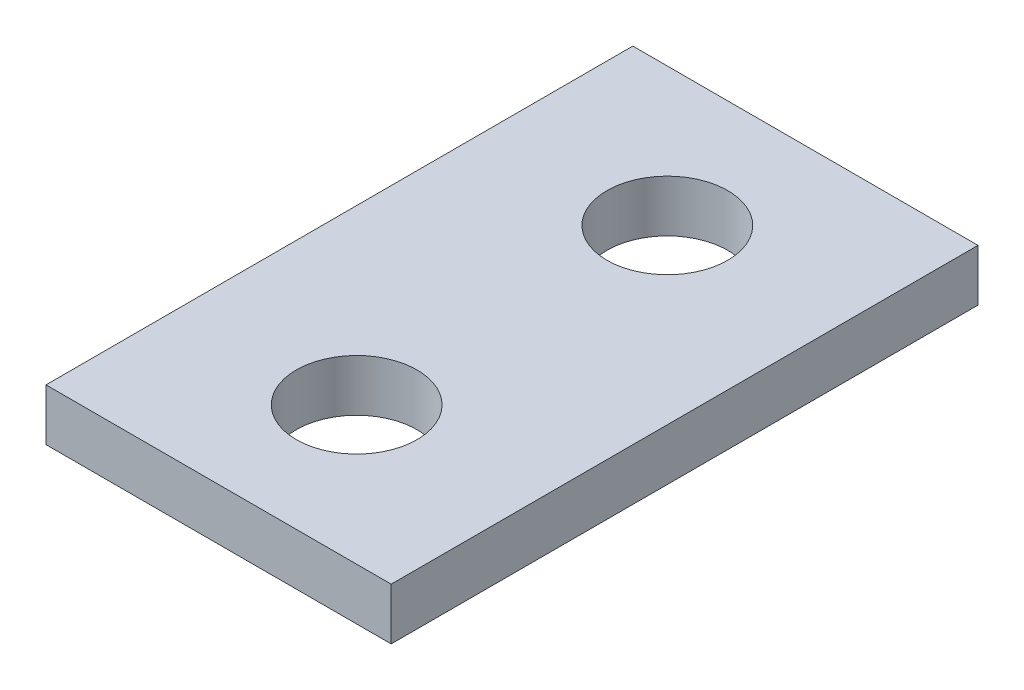
from build123d import *

# Parameters (mm, degrees)
SKETCH1_W           = 20
SKETCH1_H           = 34
SKETCH1_R           = 3.5
BOSS_EXTRUDE1_DEPTH = 3


with BuildPart() as part:
    # Sketch1 → Boss-Extrude1 (new body)
    with BuildSketch(Plane(origin=(0, 0, 0), x_dir=(1, 0, 0), z_dir=(0, 1, 0))):
        Rectangle(SKETCH1_W, SKETCH1_H)
        with Locations(Location((0, -9, 0), (0, 0, 270))):
            Circle(SKETCH1_R, mode=Mode.SUBTRACT)
        with Locations(Location((0, 9, 0), (0, 0, 270))):
            Circle(SKETCH1_R, mode=Mode.SUBTRACT)
    extrude(amount=BOSS_EXTRUDE1_DEPTH)


solid = part.part
